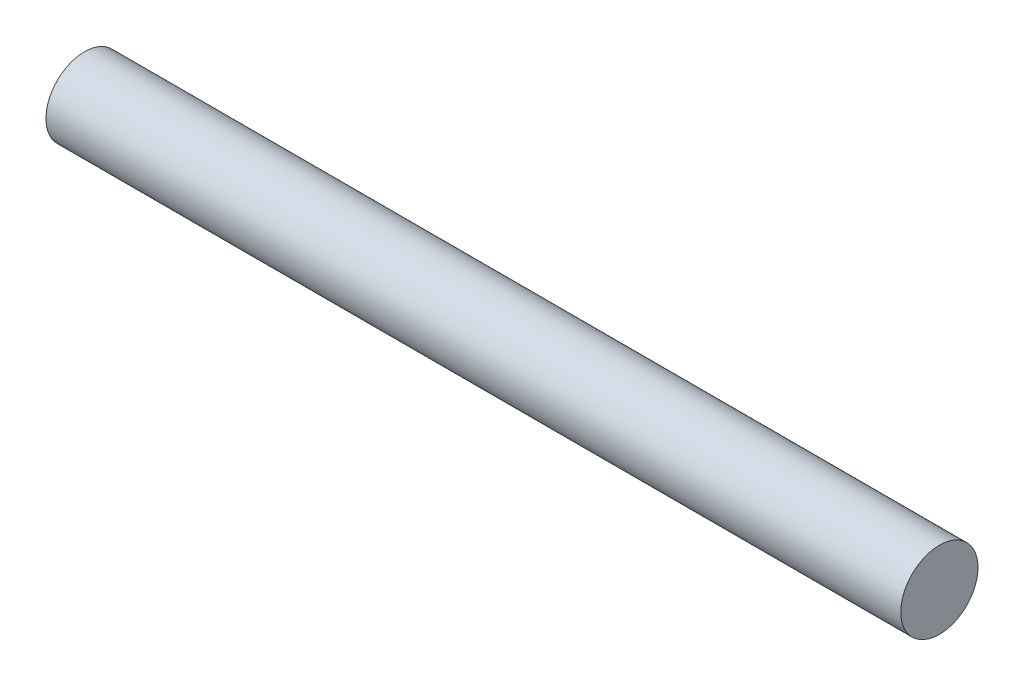
from build123d import *

# Parameters (mm, degrees)
SKETCH1_R           = 22.5
BOSS_EXTRUDE1_DEPTH = 498


with BuildPart() as part:
    # Sketch1 → Boss-Extrude1 (new body)
    with BuildSketch(Plane(origin=(0, 0, 0), x_dir=(0, 0, -1), z_dir=(1, 0, 0))):
        Circle(SKETCH1_R)
    extrude(amount=BOSS_EXTRUDE1_DEPTH)


solid = part.part
